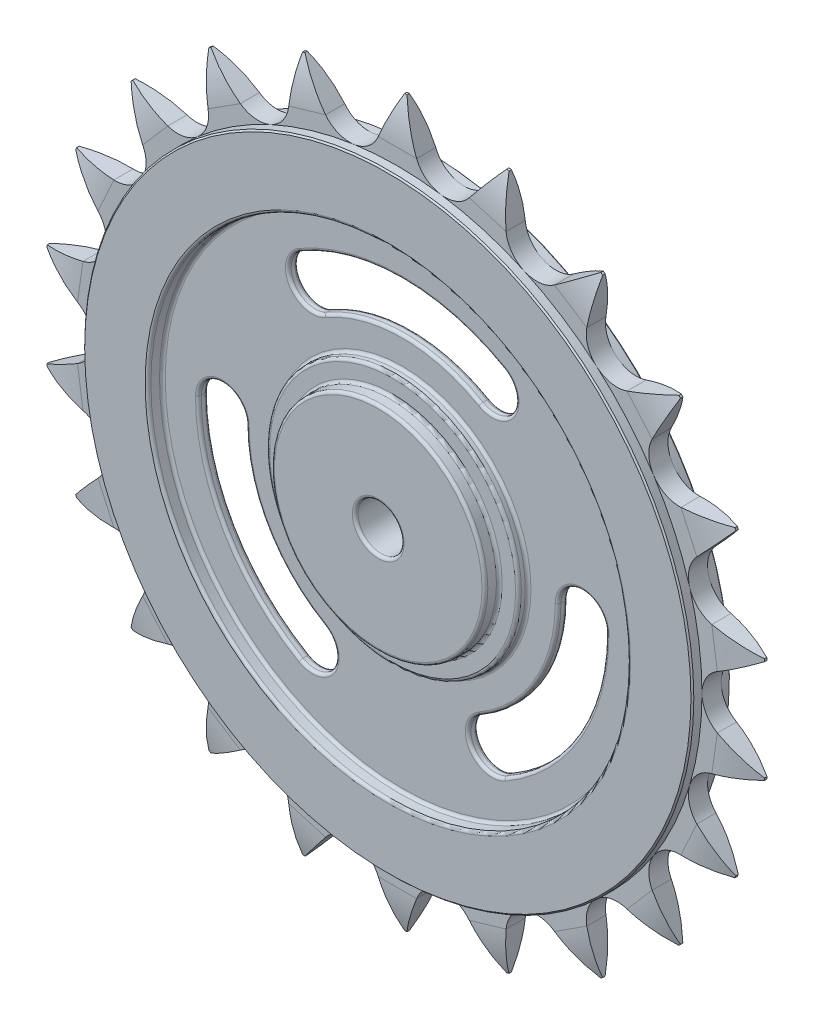
from build123d import *

# Parameters (mm, degrees)
EXTRUDE_1_DEPTH          = 2
CUT_EXTRUDE_1_DEPTH      = 6
PATTERN_CIRCULAR_1_COUNT = 22
SKETCH_6_R               = 63.5
SKETCH_6_R_2             = 50
EXTRUDE_2_DEPTH          = 4
SKETCH_7_R               = 50
SKETCH_7_R_2             = 26.25
EXTRUDE_3_DEPTH          = 1
SKETCH_8_R               = 26.25
SKETCH_8_R_2             = 22.25
EXTRUDE_4_DEPTH          = 3
SKETCH_9_R               = 22.25
SKETCH_9_R_2             = 4.8
EXTRUDE_5_DEPTH          = 6
CHAMFER_1_SIZE           = 0.3
FILLET_1_R               = 0.6


with BuildPart() as part:
    # Эскиз4 → Бобышка-Вытянуть1 (new, symmetric)
    with BuildSketch(Plane.XY):
        with BuildLine():
            Line((0.25, 75.551527718), (-0.25, 75.551527718))
            ThreePointArc((-0.25, 75.551527718), (-2.171394619, 71.197072027), (-4, 66.802843538))
            ThreePointArc((-4, 66.802843538), (-5.990959035, 64.155404301), (-9.03699223, 62.853661559))
            ThreePointArc((-9.03699223, 62.853661559), (0, 63.5), (9.03699223, 62.853661559))
            ThreePointArc((9.03699223, 62.853661559), (5.990959035, 64.155404301), (4, 66.802843538))
            ThreePointArc((4, 66.802843538), (2.171394619, 71.197072027), (0.25, 75.551527718))
        make_face()
    extrude(amount=EXTRUDE_1_DEPTH, both=True)

    # Эскиз5 → Вырез-Вытянуть1 (cut, symmetric)
    with BuildSketch(Plane(origin=(0, 0, 0), x_dir=(0, 0, -1), z_dir=(1, 0, 0))):
        with BuildLine():
            Line((-2, 66.802843538), (-3, 66.802843538))
            Line((-3, 66.802843538), (-3, 76.551527718))
            Line((-3, 76.551527718), (3, 76.551527718))
            Line((3, 76.551527718), (3, 66.802843538))
            Line((3, 66.802843538), (2, 66.802843538))
            ThreePointArc((2, 66.802843538), (1.518435694, 71.255884601), (0.25, 75.551527718))
            Line((0.25, 75.551527718), (-0.25, 75.551527718))
            ThreePointArc((-0.25, 75.551527718), (-1.518435694, 71.255884601), (-2, 66.802843538))
        make_face()
    extrude(amount=CUT_EXTRUDE_1_DEPTH, both=True, mode=Mode.SUBTRACT)


with BuildPart() as pattern_circular_1_1:
    # Круговой массив1: pattern copy
    add(part.part.rotate(Axis((0, 0, 0), (0, 0, 1)), 1 * 360 / PATTERN_CIRCULAR_1_COUNT))


with BuildPart() as pattern_circular_1_2:
    # Круговой массив1: pattern copy
    add(part.part.rotate(Axis((0, 0, 0), (0, 0, 1)), 2 * 360 / PATTERN_CIRCULAR_1_COUNT))


with BuildPart() as pattern_circular_1_3:
    # Круговой массив1: pattern copy
    add(part.part.rotate(Axis((0, 0, 0), (0, 0, 1)), 3 * 360 / PATTERN_CIRCULAR_1_COUNT))


with BuildPart() as pattern_circular_1_4:
    # Круговой массив1: pattern copy
    add(part.part.rotate(Axis((0, 0, 0), (0, 0, 1)), 4 * 360 / PATTERN_CIRCULAR_1_COUNT))


with BuildPart() as pattern_circular_1_5:
    # Круговой массив1: pattern copy
    add(part.part.rotate(Axis((0, 0, 0), (0, 0, 1)), 5 * 360 / PATTERN_CIRCULAR_1_COUNT))


with BuildPart() as pattern_circular_1_6:
    # Круговой массив1: pattern copy
    add(part.part.rotate(Axis((0, 0, 0), (0, 0, 1)), 6 * 360 / PATTERN_CIRCULAR_1_COUNT))


with BuildPart() as pattern_circular_1_7:
    # Круговой массив1: pattern copy
    add(part.part.rotate(Axis((0, 0, 0), (0, 0, 1)), 7 * 360 / PATTERN_CIRCULAR_1_COUNT))


with BuildPart() as pattern_circular_1_8:
    # Круговой массив1: pattern copy
    add(part.part.rotate(Axis((0, 0, 0), (0, 0, 1)), 8 * 360 / PATTERN_CIRCULAR_1_COUNT))


with BuildPart() as pattern_circular_1_9:
    # Круговой массив1: pattern copy
    add(part.part.rotate(Axis((0, 0, 0), (0, 0, 1)), 9 * 360 / PATTERN_CIRCULAR_1_COUNT))


with BuildPart() as pattern_circular_1_10:
    # Круговой массив1: pattern copy
    add(part.part.rotate(Axis((0, 0, 0), (0, 0, 1)), 10 * 360 / PATTERN_CIRCULAR_1_COUNT))


with BuildPart() as pattern_circular_1_11:
    # Круговой массив1: pattern copy
    add(part.part.rotate(Axis((0, 0, 0), (0, 0, 1)), 11 * 360 / PATTERN_CIRCULAR_1_COUNT))


with BuildPart() as pattern_circular_1_12:
    # Круговой массив1: pattern copy
    add(part.part.rotate(Axis((0, 0, 0), (0, 0, 1)), 12 * 360 / PATTERN_CIRCULAR_1_COUNT))


with BuildPart() as pattern_circular_1_13:
    # Круговой массив1: pattern copy
    add(part.part.rotate(Axis((0, 0, 0), (0, 0, 1)), 13 * 360 / PATTERN_CIRCULAR_1_COUNT))


with BuildPart() as pattern_circular_1_14:
    # Круговой массив1: pattern copy
    add(part.part.rotate(Axis((0, 0, 0), (0, 0, 1)), 14 * 360 / PATTERN_CIRCULAR_1_COUNT))


with BuildPart() as pattern_circular_1_15:
    # Круговой массив1: pattern copy
    add(part.part.rotate(Axis((0, 0, 0), (0, 0, 1)), 15 * 360 / PATTERN_CIRCULAR_1_COUNT))


with BuildPart() as pattern_circular_1_16:
    # Круговой массив1: pattern copy
    add(part.part.rotate(Axis((0, 0, 0), (0, 0, 1)), 16 * 360 / PATTERN_CIRCULAR_1_COUNT))


with BuildPart() as pattern_circular_1_17:
    # Круговой массив1: pattern copy
    add(part.part.rotate(Axis((0, 0, 0), (0, 0, 1)), 17 * 360 / PATTERN_CIRCULAR_1_COUNT))


with BuildPart() as pattern_circular_1_18:
    # Круговой массив1: pattern copy
    add(part.part.rotate(Axis((0, 0, 0), (0, 0, 1)), 18 * 360 / PATTERN_CIRCULAR_1_COUNT))


with BuildPart() as pattern_circular_1_19:
    # Круговой массив1: pattern copy
    add(part.part.rotate(Axis((0, 0, 0), (0, 0, 1)), 19 * 360 / PATTERN_CIRCULAR_1_COUNT))


with BuildPart() as pattern_circular_1_20:
    # Круговой массив1: pattern copy
    add(part.part.rotate(Axis((0, 0, 0), (0, 0, 1)), 20 * 360 / PATTERN_CIRCULAR_1_COUNT))


with BuildPart() as pattern_circular_1_21:
    # Круговой массив1: pattern copy
    add(part.part.rotate(Axis((0, 0, 0), (0, 0, 1)), 21 * 360 / PATTERN_CIRCULAR_1_COUNT))


with BuildPart() as part_1:
    add(part.part)

    add(pattern_circular_1_1.part)  # Бобышка-Вытянуть2 merges Круговой массив1_1

    add(pattern_circular_1_2.part)  # Бобышка-Вытянуть2 merges Круговой массив1_2

    add(pattern_circular_1_3.part)  # Бобышка-Вытянуть2 merges Круговой массив1_3

    add(pattern_circular_1_4.part)  # Бобышка-Вытянуть2 merges Круговой массив1_4

    add(pattern_circular_1_5.part)  # Бобышка-Вытянуть2 merges Круговой массив1_5

    add(pattern_circular_1_6.part)  # Бобышка-Вытянуть2 merges Круговой массив1_6

    add(pattern_circular_1_7.part)  # Бобышка-Вытянуть2 merges Круговой массив1_7

    add(pattern_circular_1_8.part)  # Бобышка-Вытянуть2 merges Круговой массив1_8

    add(pattern_circular_1_9.part)  # Бобышка-Вытянуть2 merges Круговой массив1_9

    add(pattern_circular_1_10.part)  # Бобышка-Вытянуть2 merges Круговой массив1_10

    add(pattern_circular_1_11.part)  # Бобышка-Вытянуть2 merges Круговой массив1_11

    add(pattern_circular_1_12.part)  # Бобышка-Вытянуть2 merges Круговой массив1_12

    add(pattern_circular_1_13.part)  # Бобышка-Вытянуть2 merges Круговой массив1_13

    add(pattern_circular_1_14.part)  # Бобышка-Вытянуть2 merges Круговой массив1_14

    add(pattern_circular_1_15.part)  # Бобышка-Вытянуть2 merges Круговой массив1_15

    add(pattern_circular_1_16.part)  # Бобышка-Вытянуть2 merges Круговой массив1_16

    add(pattern_circular_1_17.part)  # Бобышка-Вытянуть2 merges Круговой массив1_17

    add(pattern_circular_1_18.part)  # Бобышка-Вытянуть2 merges Круговой массив1_18

    add(pattern_circular_1_19.part)  # Бобышка-Вытянуть2 merges Круговой массив1_19

    add(pattern_circular_1_20.part)  # Бобышка-Вытянуть2 merges Круговой массив1_20

    add(pattern_circular_1_21.part)  # Бобышка-Вытянуть2 merges Круговой массив1_21
    # Эскиз6 → Бобышка-Вытянуть2 (add, symmetric)
    with BuildSketch(Plane.XY):
        Circle(SKETCH_6_R)
        Circle(SKETCH_6_R_2, mode=Mode.SUBTRACT)
    extrude(amount=EXTRUDE_2_DEPTH, both=True)

    # Эскиз7 → Бобышка-Вытянуть3 (add, symmetric)
    with BuildSketch(Plane.XY):
        Circle(SKETCH_7_R)
        Circle(SKETCH_7_R_2, mode=Mode.SUBTRACT)
        with BuildLine():
            ThreePointArc((21.25, 36.806079661), (0, 42.5), (-21.25, 36.806079661))
            ThreePointArc((-21.25, 36.806079661), (-23.080127019, 29.975952642), (-16.25, 28.145825623))
            ThreePointArc((-16.25, 28.145825623), (0, 32.5), (16.25, 28.145825623))
            ThreePointArc((16.25, 28.145825623), (23.080127019, 29.975952642), (21.25, 36.806079661))
        make_face(mode=Mode.SUBTRACT)
        with BuildLine():
            ThreePointArc((21.25, -36.806079661), (36.806079661, -21.25), (42.5, 0))
            ThreePointArc((42.5, 0), (37.5, 5), (32.5, 0))
            ThreePointArc((32.5, 0), (28.145825623, -16.25), (16.25, -28.145825623))
            ThreePointArc((16.25, -28.145825623), (14.419872981, -34.975952642), (21.25, -36.806079661))
        make_face(mode=Mode.SUBTRACT)
        with BuildLine():
            ThreePointArc((-42.5, 0), (-36.806079661, -21.25), (-21.25, -36.806079661))
            ThreePointArc((-21.25, -36.806079661), (-14.419872981, -34.975952642), (-16.25, -28.145825623))
            ThreePointArc((-16.25, -28.145825623), (-28.145825623, -16.25), (-32.5, 0))
            ThreePointArc((-32.5, 0), (-37.5, 5), (-42.5, 0))
        make_face(mode=Mode.SUBTRACT)
    extrude(amount=EXTRUDE_3_DEPTH, both=True)

    # Эскиз8 → Бобышка-Вытянуть4 (add, symmetric)
    with BuildSketch(Plane.XY):
        Circle(SKETCH_8_R)
        Circle(SKETCH_8_R_2, mode=Mode.SUBTRACT)
    extrude(amount=EXTRUDE_4_DEPTH, both=True)

    # Эскиз9 → Бобышка-Вытянуть5 (add, symmetric)
    with BuildSketch(Plane.XY):
        Circle(SKETCH_9_R)
        Circle(SKETCH_9_R_2, mode=Mode.SUBTRACT)
    extrude(amount=EXTRUDE_5_DEPTH, both=True)

    # Фаска1
    chamfer_1_edges = [part_1.edges().sort_by_distance(p)[0] for p in [
        (-63.5, 0, -4),
        (-63.5, 0, 4),
    ]]
    chamfer(chamfer_1_edges, length=CHAMFER_1_SIZE)

    # Скругление1
    fillet_1_edges = [part_1.edges().sort_by_distance(p)[0] for p in [
        (-4.8, 0, -6),
        (-22.25, 0, -6),
        (-22.25, 0, -3),
        (-26.25, 0, -3),
        (-28.145825623, -16.25, -1),
        (-14.419872981, -34.975952642, -1),
        (-36.806079661, -21.25, -1),
        (-37.5, 5, -1),
        (0, 32.5, -1),
        (-23.080127019, 29.975952642, -1),
        (0, 42.5, -1),
        (23.080127019, 29.975952642, -1),
        (-50, 0, -1),
        (-26.25, 0, -1),
        (28.145825623, -16.25, -1),
        (37.5, 5, -1),
        (36.806079661, -21.25, -1),
        (14.419872981, -34.975952642, -1),
        (-22.25, 0, 6),
        (-4.8, 0, 6),
        (-22.25, 0, 3),
        (-26.25, 0, 3),
        (-14.419872981, -34.975952642, 1),
        (-28.145825623, -16.25, 1),
        (-37.5, 5, 1),
        (-36.806079661, -21.25, 1),
        (37.5, 5, 1),
        (28.145825623, -16.25, 1),
        (14.419872981, -34.975952642, 1),
        (36.806079661, -21.25, 1),
        (-23.080127019, 29.975952642, 1),
        (0, 32.5, 1),
        (23.080127019, 29.975952642, 1),
        (0, 42.5, 1),
        (-26.25, 0, 1),
        (-50, 0, 1),
        (-50, 0, -4),
        (-50, 0, 4),
    ]]
    fillet(fillet_1_edges, radius=FILLET_1_R)


solid = part_1.part
